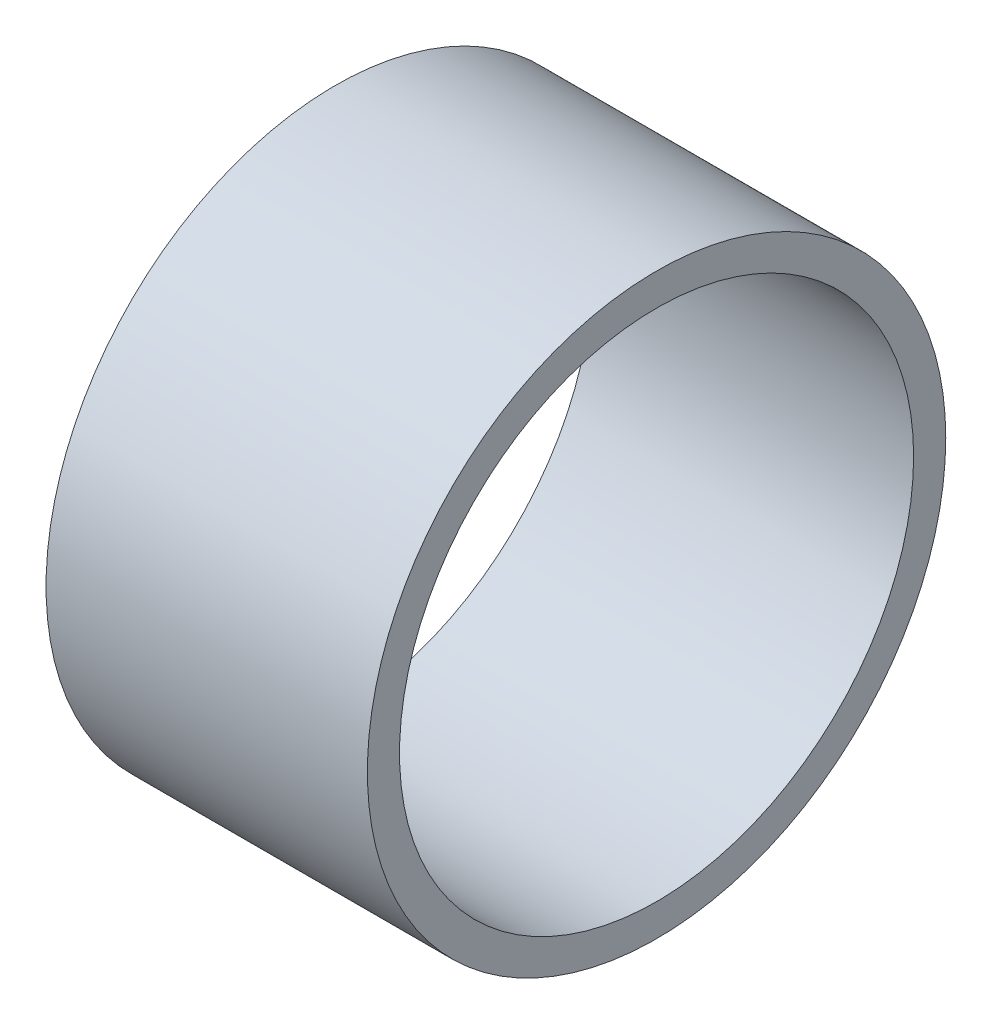
from build123d import *

# Parameters (mm, degrees)
SKIZZE1_R                       = 9
SKIZZE1_R_2                     = 8
AUFSATZ_LINEAR_AUSTRAGEN1_DEPTH = 10


with BuildPart() as part:
    # Skizze1 → Aufsatz-Linear austragen1 (new body)
    with BuildSketch(Plane(origin=(0, 0, 0), x_dir=(0, 0, -1), z_dir=(1, 0, 0))):
        Circle(SKIZZE1_R)
        Circle(SKIZZE1_R_2, mode=Mode.SUBTRACT)
    extrude(amount=AUFSATZ_LINEAR_AUSTRAGEN1_DEPTH)


solid = part.part
